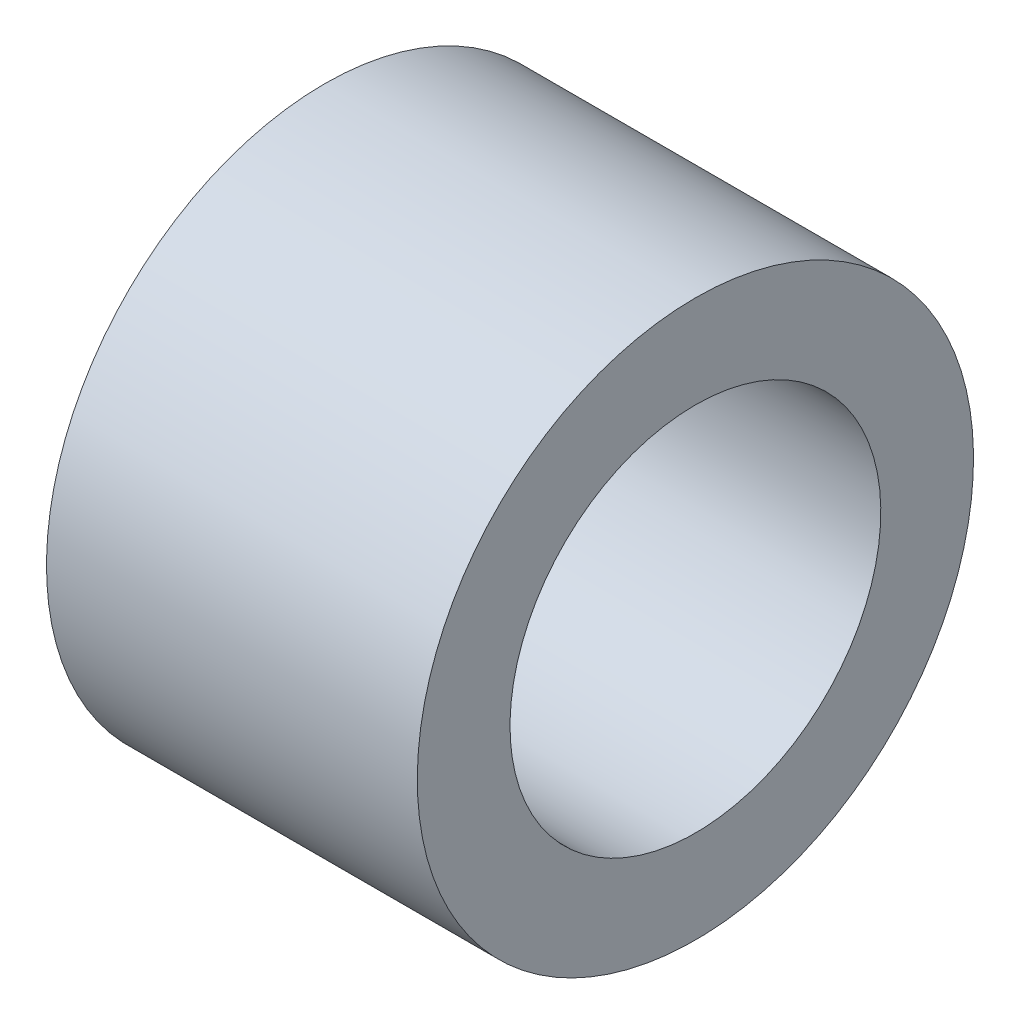
from build123d import *


with BuildPart() as part:
    # Sketch1 → Revolve1 (revolve)
    with BuildSketch(Plane.XY):
        Polygon((0, 0), (0, 6), (8, 6), (8, 4), (1, 4), (1, 0), align=None)
    revolve(axis=Axis((1, 0, 0), (-1, 0, 0)))


solid = part.part
